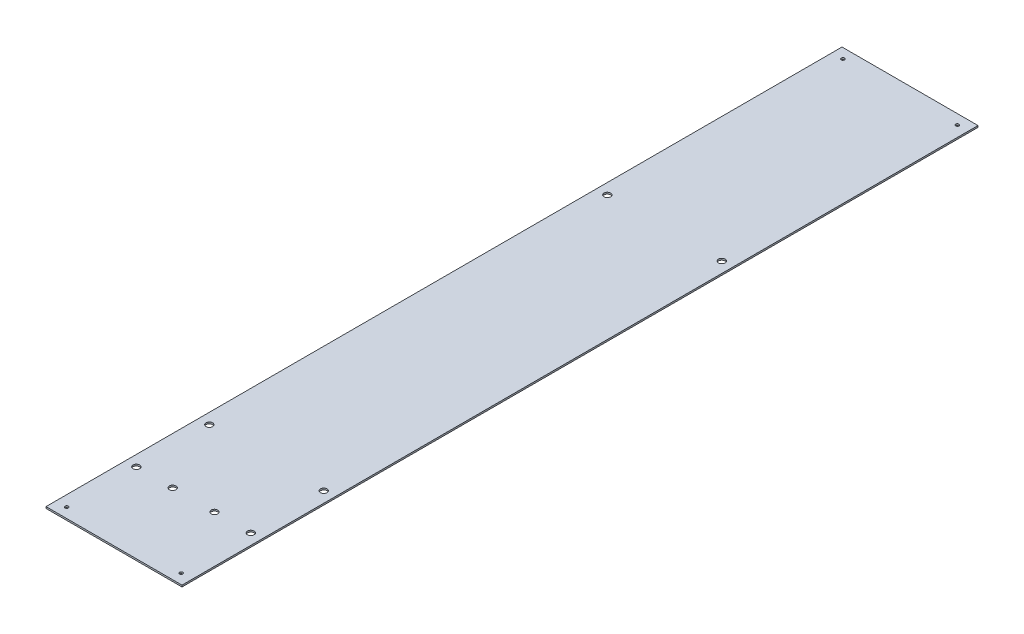
from build123d import *

# Parameters (mm, degrees)
SKETCH1_W           = 130.175
SKETCH1_H           = 762
BOSS_EXTRUDE1_DEPTH = 1.5875
SKETCH2_R           = 1.5875
SKETCH2_R_2         = 3.175
CUT_EXTRUDE2_DEPTH  = 387.522836082


with BuildPart() as part:
    # Sketch1 → Boss-Extrude1 (new body)
    with BuildSketch(Plane(origin=(0, 0, 0), x_dir=(1, 0, 0), z_dir=(0, 1, 0))):
        Rectangle(SKETCH1_W, SKETCH1_H)
    extrude(amount=-BOSS_EXTRUDE1_DEPTH)

    # Sketch2 → Cut-Extrude2 (cut, through all)
    with BuildSketch(Plane(origin=(0, 0, 0), x_dir=(1, 0, 0), z_dir=(0, 1, 0))):
        with Locations(Location((54.76875, -371.475, 0), (0, 0, 270))):
            Circle(SKETCH2_R)
        with Locations(Location((54.76875, -234.95, 0), (0, 0, 270))):
            Circle(SKETCH2_R_2)
        with Locations(Location((54.76875, 371.475, 0), (0, 0, 270))):
            Circle(SKETCH2_R)
        with Locations(Location((54.76875, 146.05, 0), (0, 0, 270))):
            Circle(SKETCH2_R_2)
        with Locations(Location((54.76875, -304.8, 0), (0, 0, 270))):
            Circle(SKETCH2_R_2)
        with Locations(Location((20.0000108, -304.8, 0), (0, 0, 270))):
            Circle(SKETCH2_R_2)
    cut_extrude2 = extrude(amount=-CUT_EXTRUDE2_DEPTH, mode=Mode.SUBTRACT)

    # Mirror2: Cut-Extrude2 across plane
    add(cut_extrude2.mirror(Plane(origin=(0, 0, 0), x_dir=(0, 0, 1), z_dir=(1, 0, 0))), mode=Mode.SUBTRACT)


solid = part.part
